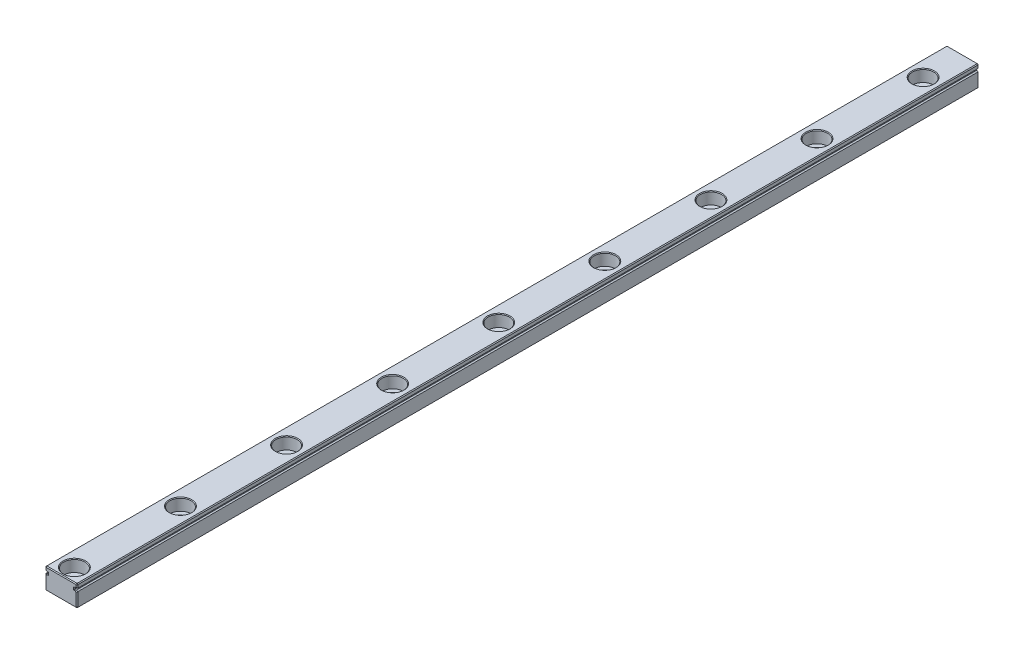
from build123d import *

# Parameters (mm, degrees)
BOSS_EXTRUDE1_DEPTH   = 470
CHAMFER1_SIZE         = 0.3
LPATTERN1_COUNT       = 12
LPATTERN1_PITCH       = 40
CROQUIS1_W            = 18.891255934
CROQUIS1_H            = 12.405534969
CORTAR_EXTRUIR2_DEPTH = 130
CHAFL_N1_SIZE         = 0.3


with BuildPart() as part:
    # Sketch1 → Boss-Extrude1 (new body)
    with BuildSketch(Plane.XY):
        with BuildLine():
            Line((0, 8), (12, 8))
            Line((12, 8), (12, 6.75))
            Line((12, 6.75), (12, 6.559016994))
            ThreePointArc((12, 6.559016994), (11.706107374, 6.475528258), (11.5, 6.25))
            Line((11.5, 6.25), (11, 6.25))
            Line((11, 6.25), (11, 5.75))
            Line((11, 5.75), (11.5, 5.75))
            ThreePointArc((11.5, 5.75), (11.706107374, 5.524471742), (12, 5.440983006))
            Line((12, 5.440983006), (12, 5.25))
            Line((12, 5.25), (12, 0))
            Line((12, 0), (0, 0))
            Line((0, 0), (0, 5.25))
            Line((0, 5.25), (0, 5.440983006))
            ThreePointArc((0, 5.440983006), (0.293892626, 5.524471742), (0.5, 5.75))
            Line((0.5, 5.75), (1, 5.75))
            Line((1, 5.75), (1, 6.25))
            Line((1, 6.25), (0.5, 6.25))
            ThreePointArc((0.5, 6.25), (0.293892626, 6.475528258), (0, 6.559016994))
            Line((0, 6.559016994), (0, 6.75))
            Line((0, 6.75), (0, 8))
        make_face()
    extrude(amount=BOSS_EXTRUDE1_DEPTH)

    # Chamfer1
    chamfer1_edges = [part.edges().sort_by_distance(p)[0] for p in [
        (12, 2.720491503, 470),
        (11.706107374, 5.524471742, 470),
        (0, 2.720491503, 0),
        (0.293892626, 5.524471742, 0),
        (0.75, 5.75, 0),
        (1, 6, 0),
        (0.75, 6.25, 0),
        (11.25, 5.75, 470),
        (0.293892626, 6.475528258, 0),
        (0, 7.279508497, 0),
        (6, 8, 0),
        (12, 7.279508497, 0),
        (11.706107374, 6.475528258, 0),
        (11, 6, 470),
        (11.25, 6.25, 0),
        (11, 6, 0),
        (11.25, 5.75, 0),
        (11.706107374, 5.524471742, 0),
        (12, 2.720491503, 0),
        (6, 0, 0),
        (11.25, 6.25, 470),
        (11.706107374, 6.475528258, 470),
        (12, 7.279508497, 470),
        (0, 8, 235),
        (12, 8, 235),
        (12, 0, 235),
        (0, 0, 235),
        (6, 8, 470),
        (0, 2.720491503, 470),
        (0, 7.279508497, 470),
        (0.293892626, 6.475528258, 470),
        (0.75, 6.25, 470),
        (1, 6, 470),
        (0.75, 5.75, 470),
        (0.293892626, 5.524471742, 470),
        (6, 0, 470),
    ]]
    chamfer(chamfer1_edges, length=CHAMFER1_SIZE)

    # Sketch3 → CBORE for M5 Hex Head Bolt1 (revolve, cut)
    with BuildSketch(Plane(origin=(6, 8, 15), x_dir=(0, 0, 1), z_dir=(1, 0, 0))):
        Polygon((0, 0), (0, 8), (2.5, 8), (2.25, 7.75), (2.25, 4.5), (4, 4.5), (4, 0.25), (4.25, 0), align=None)
    cbore_for_m5_hex_head_bolt1 = revolve(axis=Axis((6, 14.35, 15), (0, -1, 0)), mode=Mode.SUBTRACT)

    # LPattern1: CBORE for M5 Hex Head Bolt1 ×12
    with Locations(*[(0, 0, i * LPATTERN1_PITCH) for i in range(1, LPATTERN1_COUNT)]):
        add(cbore_for_m5_hex_head_bolt1, mode=Mode.SUBTRACT)

    # Croquis1 → Cortar-Extruir2 (cut)
    with BuildSketch(Plane.XY.offset(470)):
        with Locations((5.286012754, 3.624640076)):
            Rectangle(CROQUIS1_W, CROQUIS1_H)
    extrude(amount=-CORTAR_EXTRUIR2_DEPTH, mode=Mode.SUBTRACT)

    # Chaflán1
    chafl_n1_edges = [part.edges().sort_by_distance(p)[0] for p in [
        (0.15, 0.15, 340),
        (11.85, 0.15, 340),
        (0.15, 7.85, 340),
        (11.85, 7.85, 340),
        (12, 2.870491503, 340),
        (11.706107374, 5.524471742, 340),
        (11.25, 5.75, 340),
        (11, 6, 340),
        (11.25, 6.25, 340),
        (11.706107374, 6.475528258, 340),
        (12, 7.129508497, 340),
        (6, 8, 340),
        (0, 7.129508497, 340),
        (0.293892626, 6.475528258, 340),
        (0.75, 6.25, 340),
        (1, 6, 340),
        (0.75, 5.75, 340),
        (0.293892626, 5.524471742, 340),
        (0, 2.870491503, 340),
        (6, 0, 340),
    ]]
    chamfer(chafl_n1_edges, length=CHAFL_N1_SIZE)


solid = part.part
